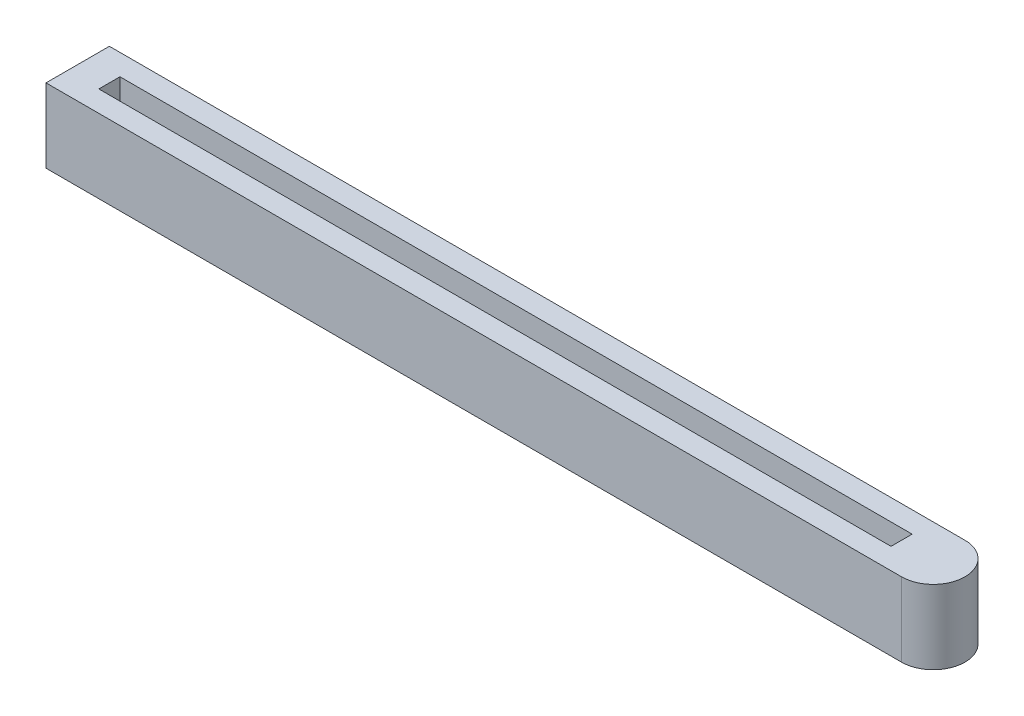
from build123d import *

# Parameters (mm, degrees)
SKETCH_1_R          = 1.5
EXTRUDE_1_DEPTH     = 3.5
SKETCH_2_W          = 37.5
SKETCH_2_H          = 1
CUT_EXTRUDE_1_DEPTH = 1.5


with BuildPart() as part:
    # 草图1 → 凸台-拉伸1 (new body)
    with BuildSketch(Plane(origin=(0, 0, 0), x_dir=(1, 0, 0), z_dir=(0, 1, 0))):
        with BuildLine():
            Line((40.5, 0), (0, 0))
            Line((0, 0), (0, -3))
            Line((0, -3), (40.5, -3))
            ThreePointArc((40.5, -3), (39, -1.5), (40.5, 0))
        make_face()
        with Locations((40.5, -1.5)):
            Circle(SKETCH_1_R)
    extrude(amount=EXTRUDE_1_DEPTH)

    # 草图2 → 切除-拉伸1 (cut)
    with BuildSketch(Plane(origin=(0, 3.5, 0), x_dir=(1, 0, 0), z_dir=(0, 1, 0))):
        with Locations((20.25, -1.5)):
            Rectangle(SKETCH_2_W, SKETCH_2_H)
    extrude(amount=-CUT_EXTRUDE_1_DEPTH, mode=Mode.SUBTRACT)


solid = part.part
